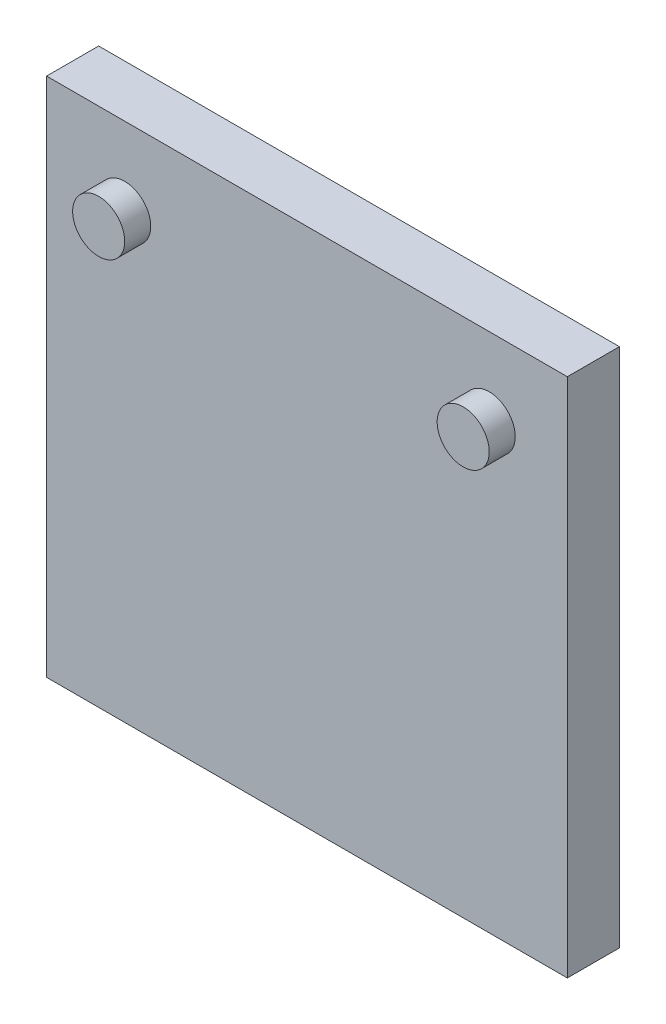
from build123d import *

# Parameters (mm, degrees)
SKETCH1_W           = 100
SKETCH1_H           = 100
BOSS_EXTRUDE1_DEPTH = 10
SKETCH2_R           = 5
BOSS_EXTRUDE2_DEPTH = 5


with BuildPart() as part:
    # Sketch1 → Boss-Extrude1 (new body)
    with BuildSketch(Plane.XY):
        with Locations((-50, 50)):
            Rectangle(SKETCH1_W, SKETCH1_H)
    extrude(amount=BOSS_EXTRUDE1_DEPTH)

    # Sketch2 → Boss-Extrude2 (add)
    with BuildSketch(Plane.XY.offset(10)):
        with Locations((-85, 85)):
            Circle(SKETCH2_R)
        with Locations((-15, 85)):
            Circle(SKETCH2_R)
    extrude(amount=BOSS_EXTRUDE2_DEPTH)


solid = part.part
